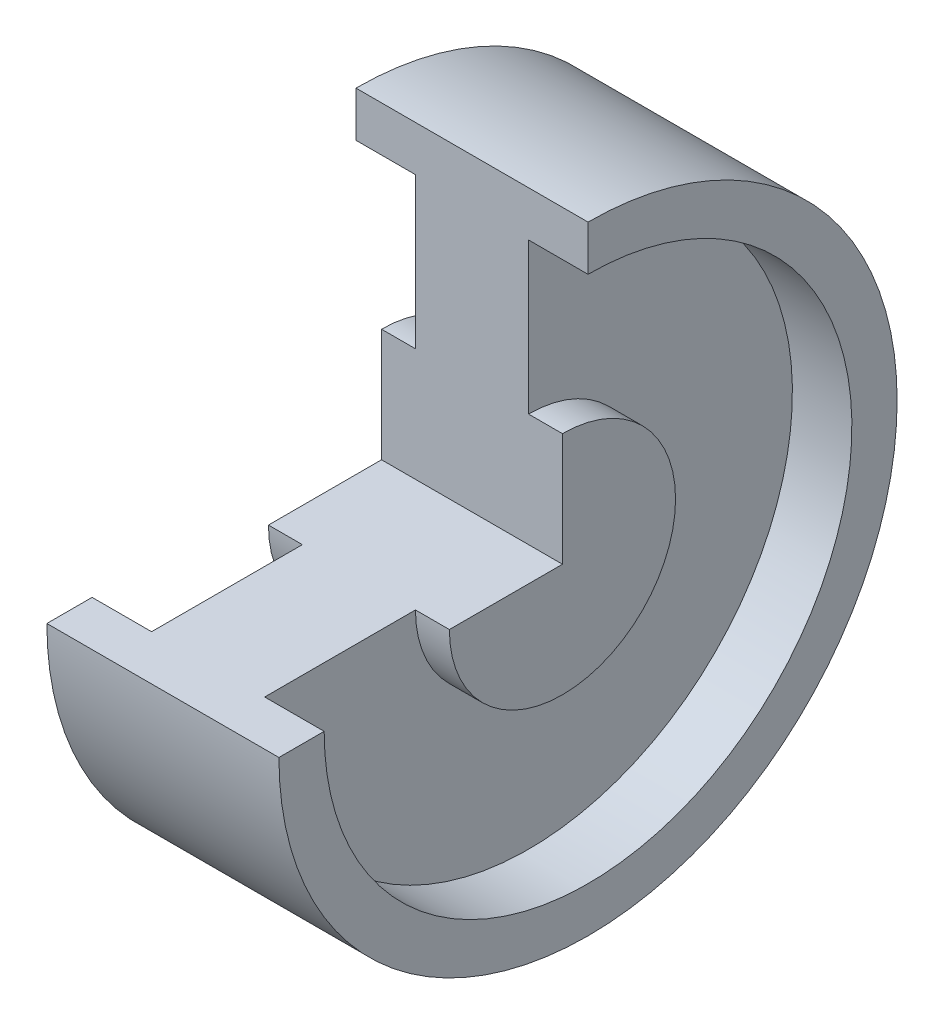
from build123d import *

# Parameters (mm, degrees)
REVOLVE3_ANGLE = 270


with BuildPart() as part:
    # Sketch1 → Revolve3 (revolve)
    with BuildSketch(Plane.XY):
        Polygon((-29.688249557, 67.967739871), (31.872847052, 67.967739871), (31.872847052, 55.967739871), (16.092298747, 55.967739871), (16.092298747, 15.967739871), (25.092298747, 15.967739871), (25.092298747, -14.032260129), (-22.907701253, -14.032260129), (-22.907701253, 15.967739871), (-13.907701253, 15.967739871), (-13.907701253, 55.967739871), (-29.688249557, 55.967739871), align=None)
    revolve(axis=Axis((25.092298747, -14.032260129, 0), (-1, 0, 0)), revolution_arc=REVOLVE3_ANGLE)


solid = part.part
